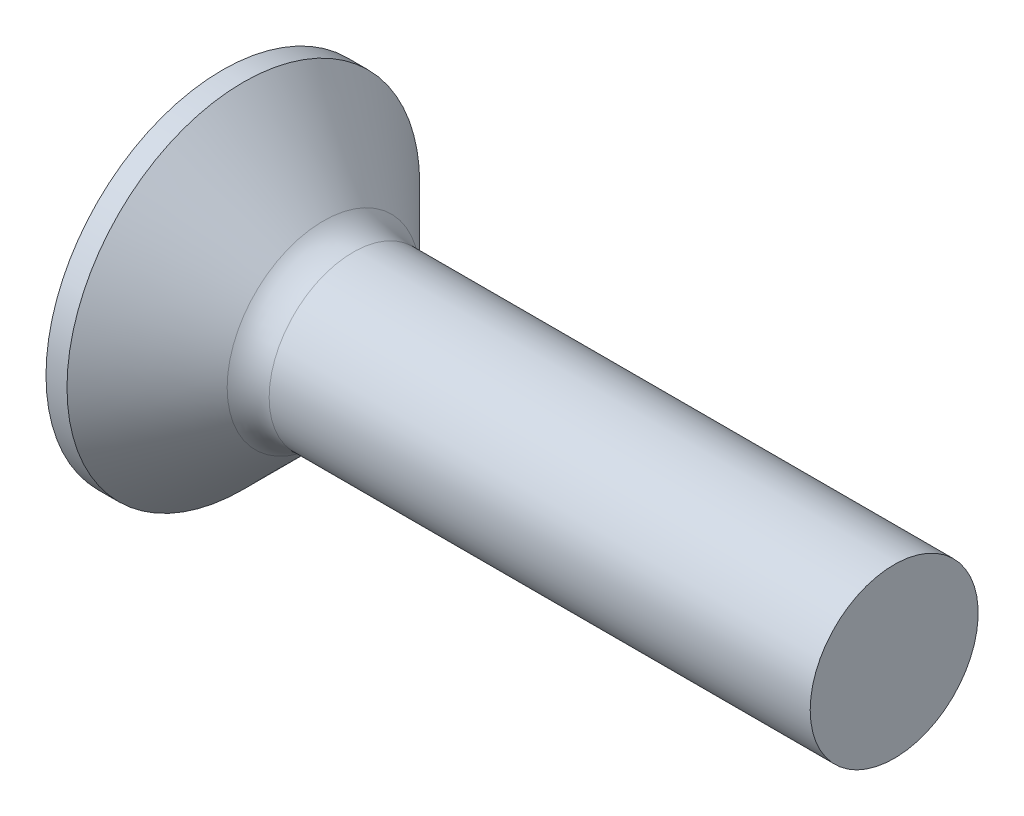
from build123d import *

# Parameters (mm, degrees)
FILLET1_R    = 1
RECPAT_COUNT = 2
RECPAT_ANGLE = 90


with BuildPart() as part:
    # BodySke → Base-Revolve (revolve)
    with BuildSketch(Plane.XY, mode=Mode.PRIVATE) as base_revolve_sk:
        Polygon((0, 0), (0, 4.2), (0.5, 4.2), (2.7, 2), (16, 2), (16, 0), align=None)
    revolve(base_revolve_sk.sketch.rotate(Axis((-6.35, 0, 0), (1, 0, 0)), 90), axis=Axis((-6.35, 0, 0), (1, 0, 0)))

    # Fillet1
    fillet1_edges = [part.edges().sort_by_distance(p)[0] for p in [
        (2.7, 0, -2),
    ]]
    fillet(fillet1_edges, radius=FILLET1_R)

    # Sketch3 → Recess section 0
    with BuildSketch(Plane.ZY):
        with BuildLine():
            Line((-0.515, 2.2), (0.515, 2.2))
            Line((0.515, 2.2), (0.515, -2.2))
            Line((0.515, -2.2), (-0.515, -2.2))
            Line((-0.515, -2.2), (-0.515, 2.2))
        make_face()
    # Sketch4 → Recess section 1
    with BuildSketch(Plane.ZY.offset(-2.51)):
        with BuildLine():
            Line((-0.515, 0.948560373), (0.515, 0.948560373))
            Line((0.515, 0.948560373), (0.515, -0.948560373))
            Line((0.515, -0.948560373), (-0.515, -0.948560373))
            Line((-0.515, -0.948560373), (-0.515, 0.948560373))
        make_face()
    recess = loft(mode=Mode.SUBTRACT)

    # RecPat: Recess ×2 about axis
    recpat_axis = Axis((0, 0, 0), (1, 0, 0))
    for i in range(1, RECPAT_COUNT):
        add(recess.rotate(recpat_axis, i * RECPAT_ANGLE / (RECPAT_COUNT - 1)), mode=Mode.SUBTRACT)

    # RecCorSke → RecessCore (revolve, cut)
    with BuildSketch(Plane.XY, mode=Mode.PRIVATE) as recesscore_sk:
        Polygon((0, 0), (0, 1.026516298), (2.51, 0.851), (2.786506661, 0), align=None)
    revolve(recesscore_sk.sketch.rotate(Axis((-3.175, 0, 0), (1, 0, 0)), 90), axis=Axis((-3.175, 0, 0), (1, 0, 0)), mode=Mode.SUBTRACT)


solid = part.part
